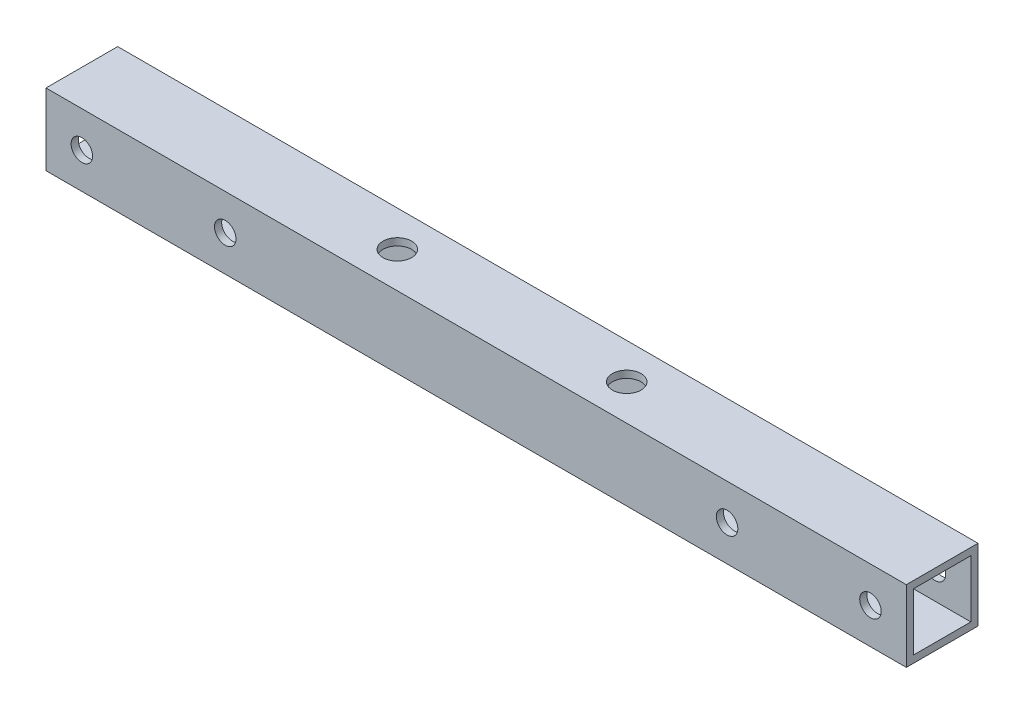
from build123d import *

# Parameters (mm, degrees)
SKETCH_1_W          = 10
SKETCH_1_H          = 10
SKETCH_1_W_2        = 8
SKETCH_1_H_2        = 8
EXTRUDE_1_DEPTH     = 120
SKETCH_2_R          = 2
CUT_EXTRUDE_1_DEPTH = 121.519707932
SKETCH_3_R          = 1.5
CUT_EXTRUDE_2_DEPTH = 121.519707932


with BuildPart() as part:
    # ｽｹｯﾁ1 → 押し出し-薄板1 (new body)
    with BuildSketch(Plane(origin=(0, 0, 0), x_dir=(0, 0, -1), z_dir=(1, 0, 0))):
        Rectangle(SKETCH_1_W, SKETCH_1_H)
        Rectangle(SKETCH_1_W_2, SKETCH_1_H_2, mode=Mode.SUBTRACT)
    extrude(amount=EXTRUDE_1_DEPTH)

    # ｽｹｯﾁ2 → ｶｯﾄ - 押し出し1 (cut, through all)
    with BuildSketch(Plane(origin=(0, 5, 0), x_dir=(1, 0, 0), z_dir=(0, 1, 0))):
        with Locations(Location((44, 0, 0), (0, 0, 270))):
            Circle(SKETCH_2_R)
        with Locations(Location((76, 0, 0), (0, 0, 270))):
            Circle(SKETCH_2_R)
    extrude(amount=-CUT_EXTRUDE_1_DEPTH, mode=Mode.SUBTRACT)

    # ｽｹｯﾁ3 → ｶｯﾄ - 押し出し2 (cut, through all)
    with BuildSketch(Plane.XY.offset(5)):
        with Locations((5, 0)):
            Circle(SKETCH_3_R)
        with Locations(Location((115, 0, 0), (0, 0, 180))):
            Circle(SKETCH_3_R)
        with Locations((25, 0)):
            Circle(SKETCH_3_R)
        with Locations(Location((95, 0, 0), (0, 0, 180))):
            Circle(SKETCH_3_R)
    extrude(amount=-CUT_EXTRUDE_2_DEPTH, mode=Mode.SUBTRACT)


solid = part.part
